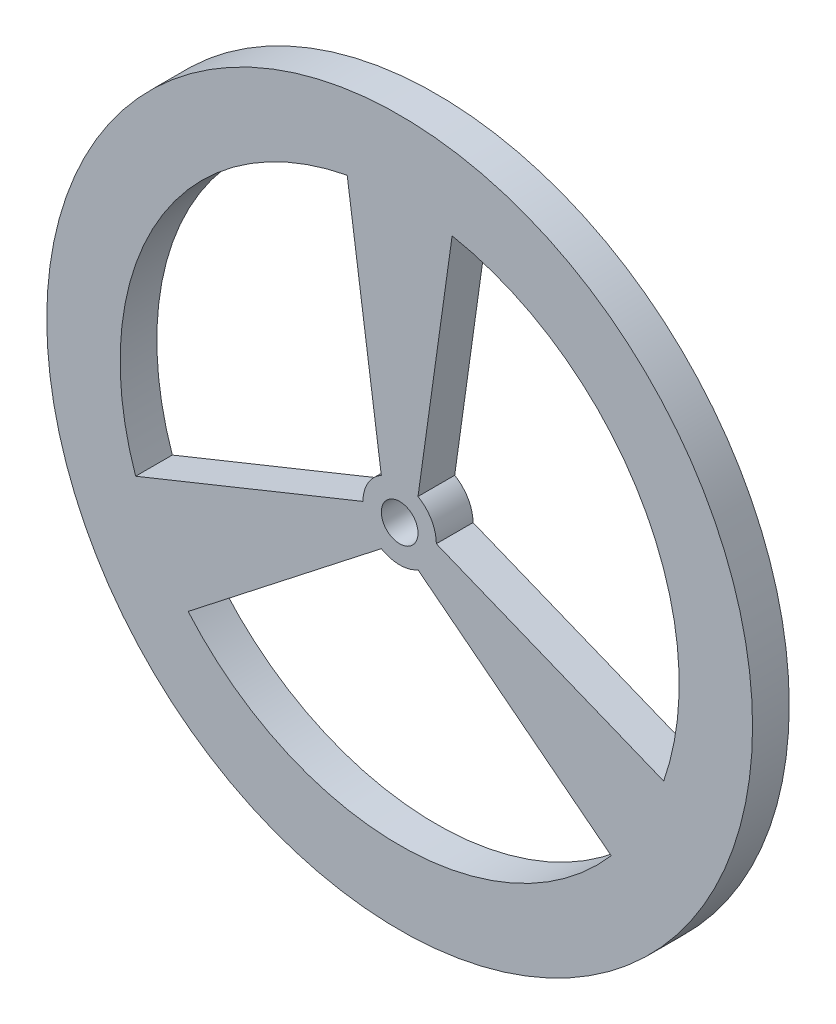
from build123d import *

# Parameters (mm, degrees)
SKETCH1_R           = 48.1
SKETCH1_R_2         = 2.5
BOSS_EXTRUDE1_DEPTH = 5


with BuildPart() as part:
    # Sketch1 → Boss-Extrude1 (new body)
    with BuildSketch(Plane.XY):
        Circle(SKETCH1_R)
        with BuildLine():
            Line((-7.150888472, 37.422918032), (-2.5, 4.330127019))
            ThreePointArc((-2.5, 4.330127019), (-4.330127019, 2.5), (-5, 0))
            Line((-5, 0), (-35.984641936, -12.51860794))
            ThreePointArc((-35.984641936, -12.51860794), (-32.995567884, 19.05), (-7.150888472, 37.422918032))
        make_face(mode=Mode.SUBTRACT)
        with BuildLine():
            Line((2.5, 4.330127019), (7.150888472, 37.422918032))
            ThreePointArc((7.150888472, 37.422918032), (32.995567884, 19.05), (35.984641936, -12.51860794))
            Line((35.984641936, -12.51860794), (5, 0))
            ThreePointArc((5, 0), (4.330127019, 2.5), (2.5, 4.330127019))
        make_face(mode=Mode.SUBTRACT)
        with BuildLine():
            ThreePointArc((28.833753464, -24.904310092), (0, -38.1), (-28.833753464, -24.904310092))
            Line((-28.833753464, -24.904310092), (-2.5, -4.330127019))
            ThreePointArc((-2.5, -4.330127019), (0, -5), (2.5, -4.330127019))
            Line((2.5, -4.330127019), (28.833753464, -24.904310092))
        make_face(mode=Mode.SUBTRACT)
        Circle(SKETCH1_R_2, mode=Mode.SUBTRACT)
    extrude(amount=BOSS_EXTRUDE1_DEPTH)


solid = part.part
